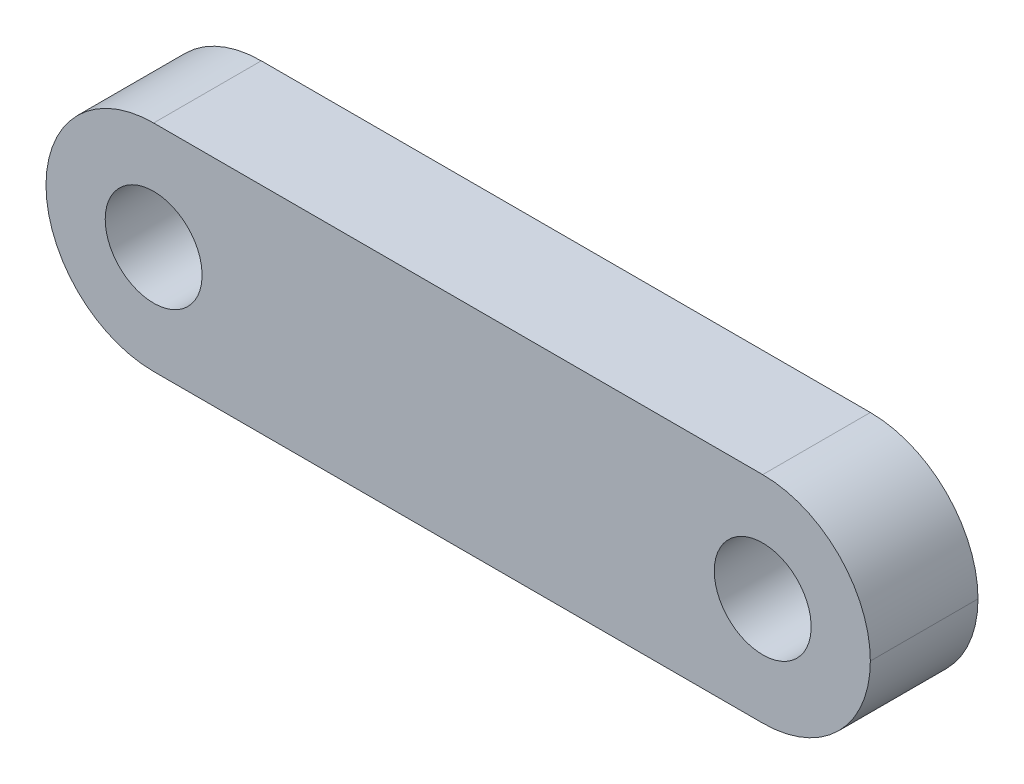
from build123d import *

# Parameters (mm, degrees)
SKETCH_1_R      = 1.35
EXTRUDE_1_DEPTH = 3


with BuildPart() as part:
    # 草图1 → 凸台-拉伸1 (new body)
    with BuildSketch(Plane.XY.offset(3)):
        with BuildLine():
            Line((-9.200145331, 0), (7.774087823, 0))
            ThreePointArc((7.774087823, 0), (9.895408166, 0.878679656), (10.774087823, 3))
            ThreePointArc((10.774087823, 3), (9.89505475, 5.120673867), (7.774087989, 5.999))
            Line((7.774087989, 5.999), (-9.200145164, 5.999))
            ThreePointArc((-9.200145164, 5.999), (-11.321465508, 5.120320344), (-12.200145164, 2.999))
            ThreePointArc((-12.200145164, 2.999), (-11.321112092, 0.878326133), (-9.200145331, 0))
        make_face()
        with Locations(Location((-9.200145331, 3, 0), (0, 0, 180))):
            Circle(SKETCH_1_R, mode=Mode.SUBTRACT)
        with Locations(Location((7.774087823, 3, 0), (0, 0, 180))):
            Circle(SKETCH_1_R, mode=Mode.SUBTRACT)
    extrude(amount=-EXTRUDE_1_DEPTH)


solid = part.part
